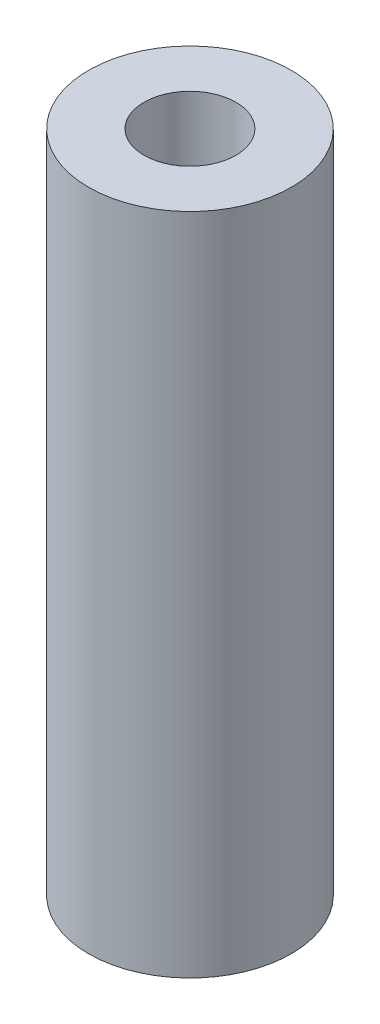
from build123d import *

# Parameters (mm, degrees)
SKETCH1_R           = 5.955
BOSS_EXTRUDE1_DEPTH = 39
SKETCH2_R           = 2.7
CUT_EXTRUDE1_DEPTH  = 4.5


with BuildPart() as part:
    # Sketch1 → Boss-Extrude1 (new body)
    with BuildSketch(Plane(origin=(0, 0, 0), x_dir=(1, 0, 0), z_dir=(0, 1, 0))):
        with Locations(Location((0, 0, 0), (0, 0, 270))):
            Circle(SKETCH1_R)
    extrude(amount=BOSS_EXTRUDE1_DEPTH)

    # Sketch2 → Cut-Extrude1 (cut)
    with BuildSketch(Plane(origin=(0, 39, 0), x_dir=(1, 0, 0), z_dir=(0, 1, 0))):
        with Locations(Location((0, 0, 0), (0, 0, 270))):
            Circle(SKETCH2_R)
    extrude(amount=-CUT_EXTRUDE1_DEPTH, mode=Mode.SUBTRACT)


solid = part.part
